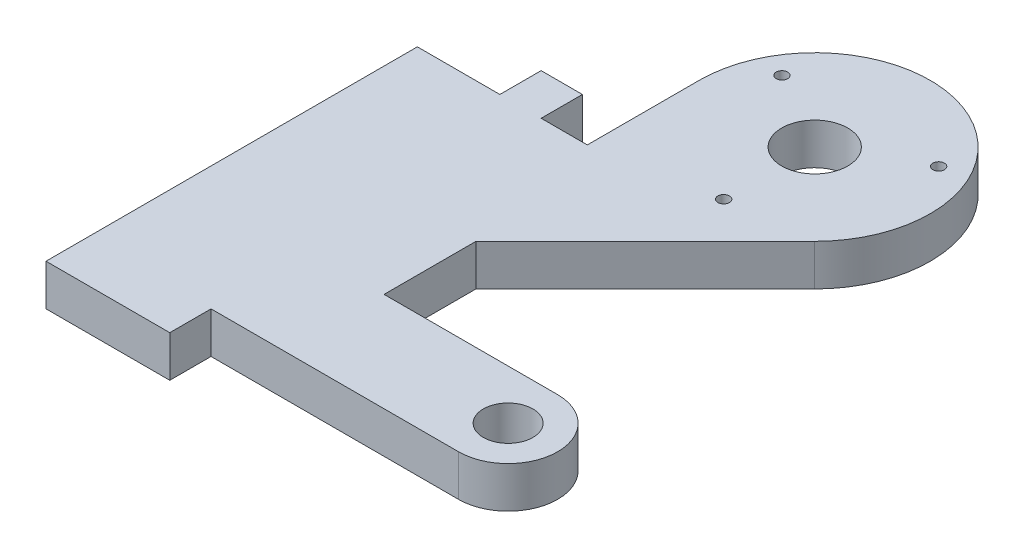
from build123d import *

# Parameters (mm, degrees)
SKETCH2_R           = 14
SKETCH2_R_2         = 4
SKETCH2_R_3         = 0.7
SKETCH2_W           = 5
SKETCH2_H           = 5
SKETCH2_R_4         = 3
SKETCH2_W_2         = 15
BOSS_EXTRUDE2_DEPTH = 5


with BuildPart() as part:
    # Sketch2 → Boss-Extrude2 (new body)
    # profile 1 of 6: a face of its own
    with BuildSketch(Plane(origin=(0, 0, 0), x_dir=(1, 0, 0), z_dir=(0, 1, 0))):
        with Locations((34.59438676, 53.562546918)):
            Circle(SKETCH2_R)
        with Locations(Location((34.59438676, 53.562546918, 0), (0, 0, 270))):
            Circle(SKETCH2_R_2, mode=Mode.SUBTRACT)
        with Locations(Location((34.557412927, 42.562609058, 0), (0, 0, 270))):
            Circle(SKETCH2_R_3, mode=Mode.SUBTRACT)
        with Locations(Location((25.086648049, 59.094536127, 0), (0, 0, 270))):
            Circle(SKETCH2_R_3, mode=Mode.SUBTRACT)
        with Locations(Location((44.139099303, 59.03049557, 0), (0, 0, 270))):
            Circle(SKETCH2_R_3, mode=Mode.SUBTRACT)
    # profile 2 of 6: a face of its own
    with BuildSketch(Plane(origin=(0, 0, 0), x_dir=(1, 0, 0), z_dir=(0, 1, 0))):
        with BuildLine():
            ThreePointArc((44.493881696, 43.663051982), (29.236818707, 40.628233463), (20.59438676, 53.562546918))
            Line((20.59438676, 53.562546918), (20.59438676, 40))
            Line((20.59438676, 40), (23.964739417, 40))
            Line((23.964739417, 40), (23.964739417, 23.133909702))
            Line((23.964739417, 23.133909702), (27.177730802, 26.346901087))
            Line((27.177730802, 26.346901087), (44.493881696, 43.663051982))
        make_face()
    # profile 3 of 6: a face of its own
    with BuildSketch(Plane(origin=(0, 0, 0), x_dir=(1, 0, 0), z_dir=(0, 1, 0))):
        Polygon((23.964739417, 40), (20.59438676, 40), (15, 40), (10, 40), (0, 40), (0, 0), (15, 0), (23.964739417, 0), (23.964739417, 12), (23.964739417, 23.133909702), align=None)
    # profile 4 of 6: a face of its own
    with BuildSketch(Plane(origin=(0, 0, 0), x_dir=(1, 0, 0), z_dir=(0, 1, 0))):
        with Locations((12.5, 42.5)):
            Rectangle(SKETCH2_W, SKETCH2_H)
    # profile 5 of 6: a face of its own
    with BuildSketch(Plane(origin=(0, 0, 0), x_dir=(1, 0, 0), z_dir=(0, 1, 0))):
        with BuildLine():
            Line((45, 12), (23.964739417, 12))
            Line((23.964739417, 12), (23.964739417, 0))
            Line((23.964739417, 0), (45, 0))
            ThreePointArc((45, 0), (51, 6), (45, 12))
        make_face()
        with Locations(Location((45, 6, 0), (0, 0, 270))):
            Circle(SKETCH2_R_4, mode=Mode.SUBTRACT)
    # profile 6 of 6: a face of its own
    with BuildSketch(Plane(origin=(0, 0, 0), x_dir=(1, 0, 0), z_dir=(0, 1, 0))):
        with Locations((7.5, -2.5)):
            Rectangle(SKETCH2_W_2, SKETCH2_H)
    extrude(amount=BOSS_EXTRUDE2_DEPTH)


solid = part.part
